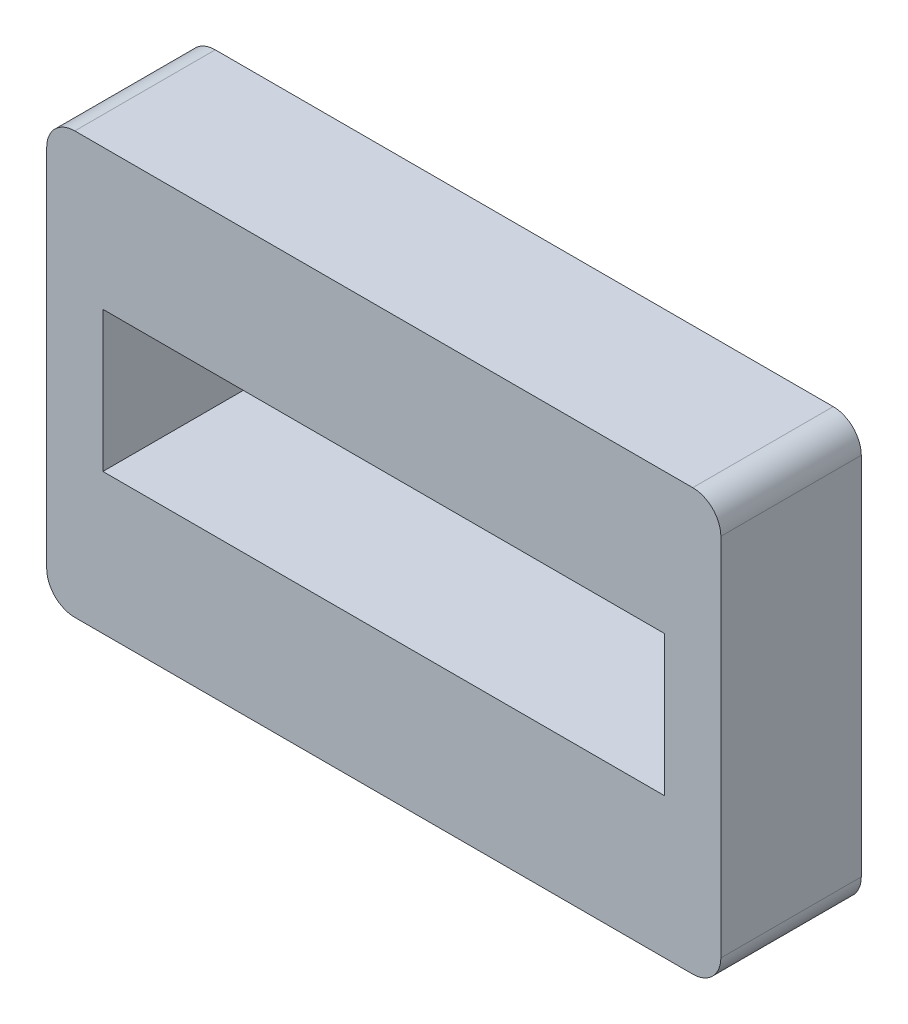
from build123d import *

# Parameters (mm, degrees)
SKETCH1_W           = 24
SKETCH1_H           = 5
BOSS_EXTRUDE1_DEPTH = 15
SKETCH2_W           = 20
SKETCH2_H           = 5
CUT_EXTRUDE1_DEPTH  = 15
FILLET2_R           = 1


with BuildPart() as part:
    # Sketch1 → Boss-Extrude1 (new body)
    with BuildSketch(Plane(origin=(0, 0, 0), x_dir=(1, 0, 0), z_dir=(0, 1, 0))):
        Rectangle(SKETCH1_W, SKETCH1_H)
    extrude(amount=BOSS_EXTRUDE1_DEPTH)

    # Sketch2 → Cut-Extrude1 (cut)
    with BuildSketch(Plane(origin=(0, 0, -2.5), x_dir=(-1, 0, 0), z_dir=(0, 0, -1))):
        with Locations((0, 7.5)):
            Rectangle(SKETCH2_W, SKETCH2_H)
    extrude(amount=-CUT_EXTRUDE1_DEPTH, mode=Mode.SUBTRACT)

    # Fillet2
    fillet2_edges = [part.edges().sort_by_distance(p)[0] for p in [
        (12, 15, 0),
        (-12, 15, 0),
        (12, 0, 0),
        (-12, 0, 0),
    ]]
    fillet(fillet2_edges, radius=FILLET2_R)


solid = part.part
